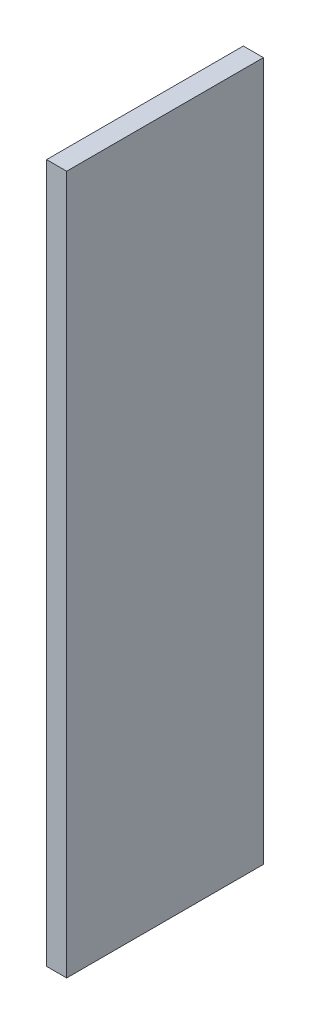
from build123d import *

# Parameters (mm, degrees)
SKETCH1_W           = 0.49
SKETCH1_H           = 1.74
BOSS_EXTRUDE1_DEPTH = 0.05


with BuildPart() as part:
    # Sketch1 → Boss-Extrude1 (new body)
    with BuildSketch(Plane.ZY):
        with Locations((-0.005, 0)):
            Rectangle(SKETCH1_W, SKETCH1_H)
    extrude(amount=-BOSS_EXTRUDE1_DEPTH)


solid = part.part
